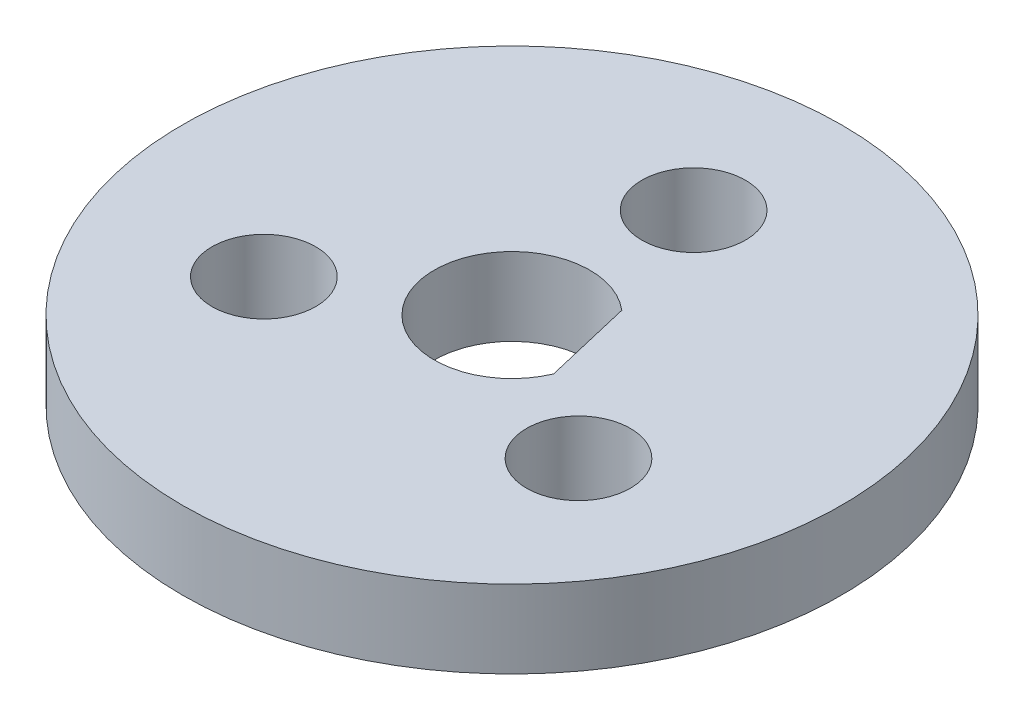
from build123d import *

# Parameters (mm, degrees)
SKETCH1_R           = 12.7
BOSS_EXTRUDE1_DEPTH = 3
CUT_EXTRUDE1_DEPTH  = 10
SKETCH3_R           = 2
CUT_EXTRUDE2_DEPTH  = 5


with BuildPart() as part:
    # Sketch1 → Boss-Extrude1 (new body)
    with BuildSketch(Plane(origin=(0, 0, 0), x_dir=(1, 0, 0), z_dir=(0, 1, 0))):
        with Locations(Location((0, 0, 0), (0, 0, 270))):
            Circle(SKETCH1_R)
    extrude(amount=BOSS_EXTRUDE1_DEPTH)

    # Sketch2 → Cut-Extrude1 (cut)
    with BuildSketch(Plane(origin=(0, 3, 0), x_dir=(1, 0, 0), z_dir=(0, 1, 0))):
        with BuildLine():
            Line((2.765935685, -1.161722767), (1.956504764, 2.274222748))
            ThreePointArc((1.956504764, 2.274222748), (-2.92006701, -0.687901633), (2.765935685, -1.161722767))
        make_face()
    extrude(amount=-CUT_EXTRUDE1_DEPTH, mode=Mode.SUBTRACT)

    # Sketch3 → Cut-Extrude2 (cut)
    with BuildSketch(Plane(origin=(0, 3, 0), x_dir=(1, 0, 0), z_dir=(0, 1, 0))):
        with Locations(Location((0, 7, 0), (0, 0, 270))):
            Circle(SKETCH3_R)
        with Locations(Location((6.062177826, -3.5, 0), (0, 0, 270))):
            Circle(SKETCH3_R)
        with Locations(Location((-6.062177826, -3.5, 0), (0, 0, 270))):
            Circle(SKETCH3_R)
    extrude(amount=-CUT_EXTRUDE2_DEPTH, mode=Mode.SUBTRACT)


solid = part.part
